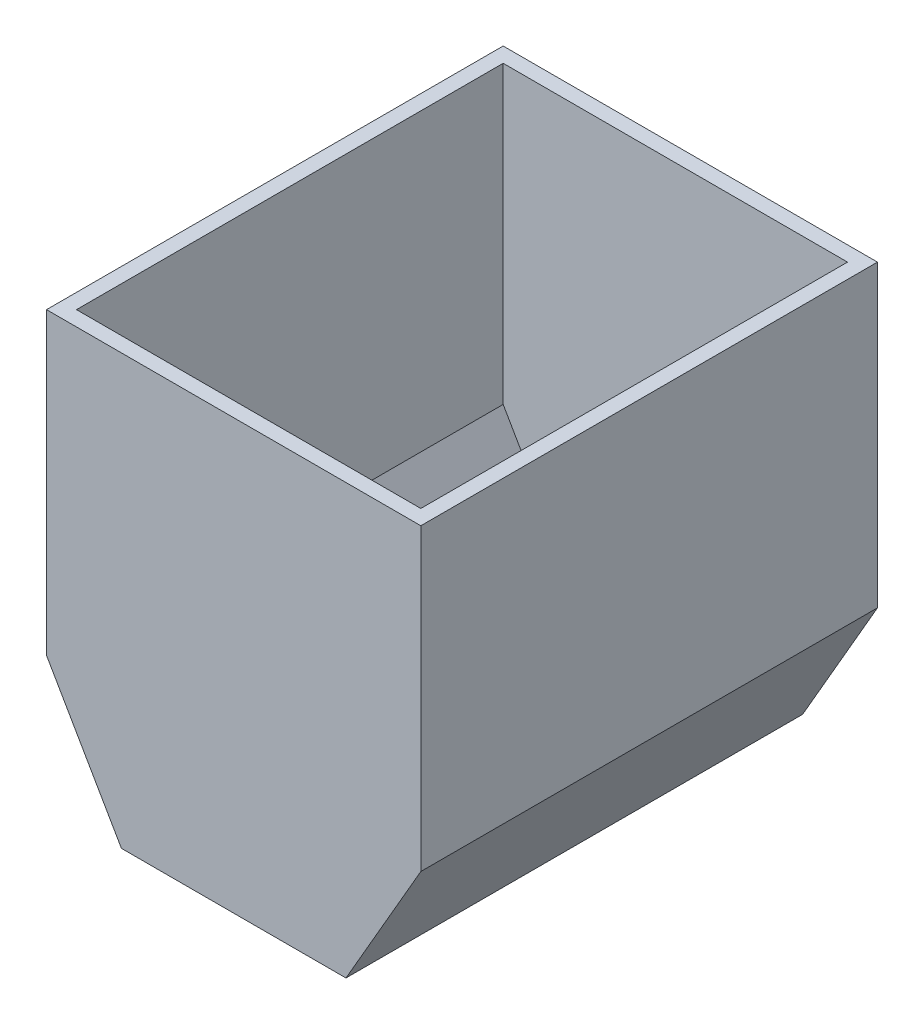
from build123d import *

# Parameters (mm, degrees)
BOSS_EXTRUDE1_DEPTH = 38.735
SHELL1_T            = -2.54
SKETCH4_W           = 35.167060632
SKETCH4_H           = 72.39
CUT_EXTRUDE1_DEPTH  = 87.281603677


with BuildPart() as part:
    # Sketch1 → Boss-Extrude1 (new, symmetric)
    with BuildSketch(Plane.XY):
        Polygon((-19.05, 0), (19.05, 0), (31.75, 21.997045256), (31.75, 72.797045256), (-31.75, 72.797045256), (-31.75, 21.997045256), align=None)
    extrude(amount=BOSS_EXTRUDE1_DEPTH, both=True)

    # Shell1
    shell1_openings = [part.faces().sort_by_distance(p)[0] for p in [
        (0, 72.797045256, 0),
    ]]
    offset(amount=SHELL1_T, openings=shell1_openings, kind=Kind.INTERSECTION)

    # Sketch4 → Cut-Extrude1 (cut, through all)
    with BuildSketch(Plane(origin=(0, 2.54, 0), x_dir=(1, 0, 0), z_dir=(0, 1, 0))):
        Rectangle(SKETCH4_W, SKETCH4_H)
    extrude(amount=-CUT_EXTRUDE1_DEPTH, mode=Mode.SUBTRACT)


solid = part.part
